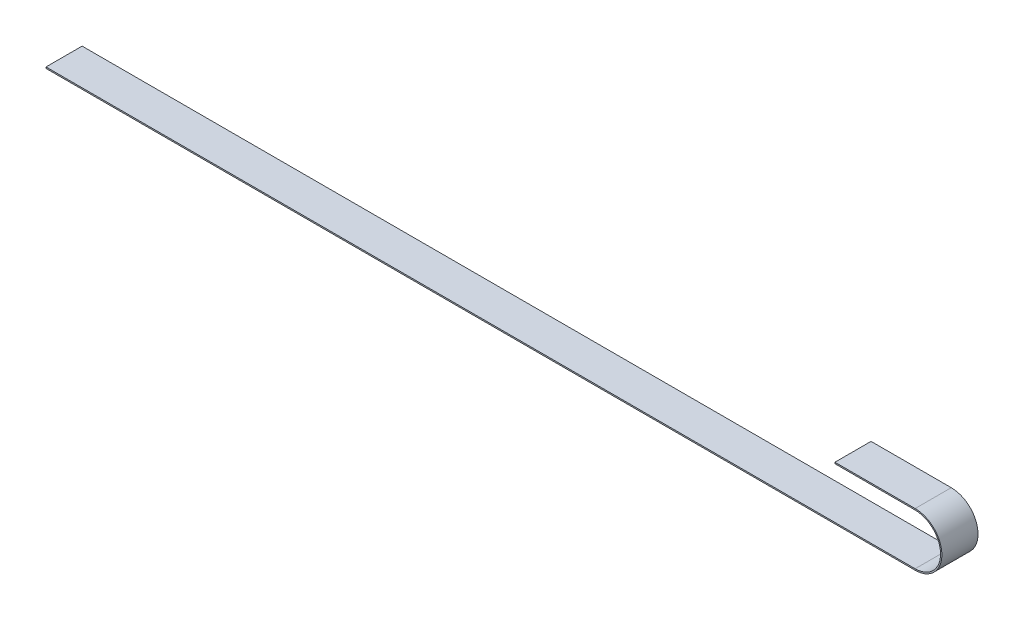
from build123d import *

# Parameters (mm, degrees)
EXTRUDE_THIN1_DEPTH = 13.5


with BuildPart() as part:
    # Sketch1 → Extrude-Thin1 (new, symmetric)
    with BuildSketch(Plane.XY):
        with BuildLine():
            Line((0, 0), (650, 0))
            ThreePointArc((650, 0), (670, 20), (650, 40))
            Line((650, 40), (590, 40))
            Line((590, 40), (590, 39))
            Line((590, 39), (650, 39))
            ThreePointArc((650, 39), (669, 20), (650, 1))
            Line((650, 1), (0, 1))
            Line((0, 1), (0, 0))
        make_face()
    extrude(amount=EXTRUDE_THIN1_DEPTH, both=True)


solid = part.part
